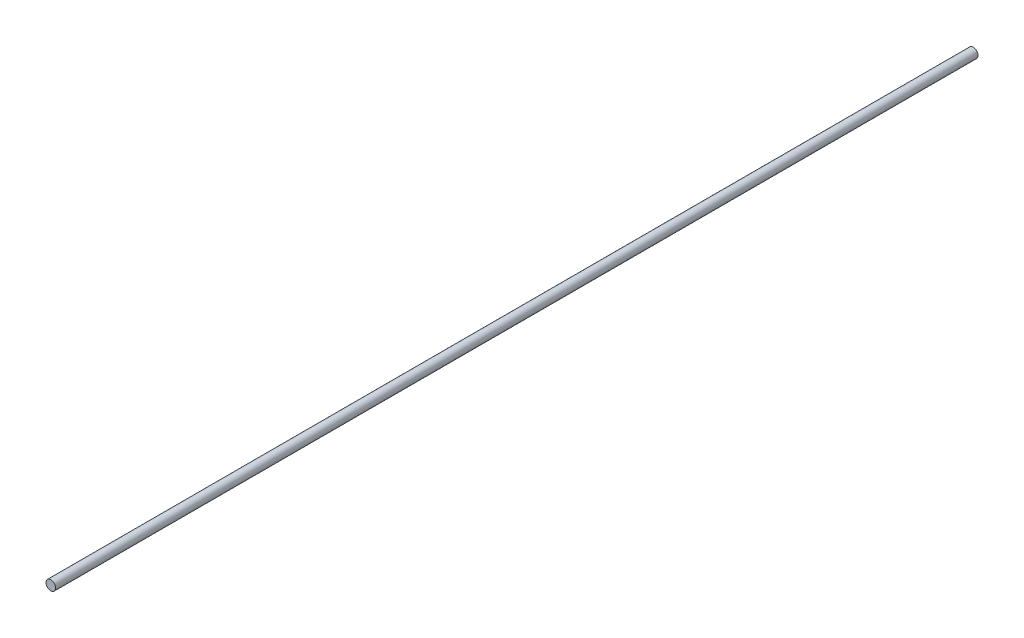
from build123d import *

# Parameters (mm, degrees)
SKETCH1_R           = 4.7625
BOSS_EXTRUDE1_DEPTH = 457.2


with BuildPart() as part:
    # Sketch1 → Boss-Extrude1 (new, symmetric)
    with BuildSketch(Plane.XY):
        Circle(SKETCH1_R)
    extrude(amount=BOSS_EXTRUDE1_DEPTH, both=True)


solid = part.part
